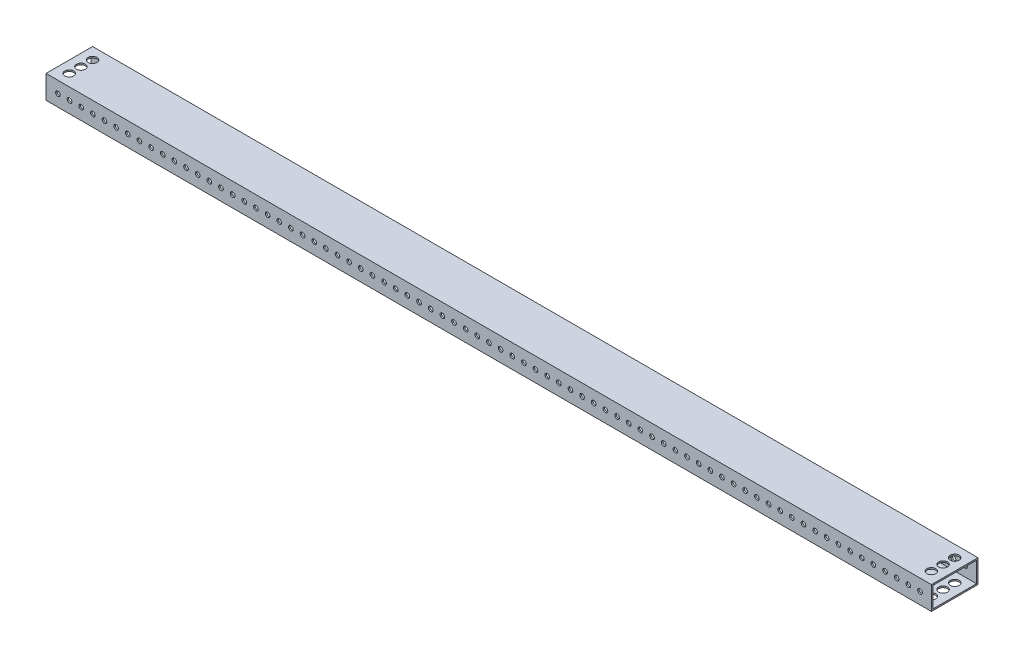
from build123d import *

# Parameters (mm, degrees)
SKETCH1_W           = 965.2
SKETCH1_H           = 50.8
BOSS_EXTRUDE1_DEPTH = 25.4
SKETCH2_W           = 47.577219443
SKETCH2_H           = 22.157059011
CUT_EXTRUDE1_DEPTH  = 966.868189765
SKETCH3_R           = 2.54
CUT_EXTRUDE2_DEPTH  = 486.930612331
SKETCH4_R           = 4.826
CUT_EXTRUDE3_DEPTH  = 484.934995635


with BuildPart() as part:
    # Sketch1 → Boss-Extrude1 (new body)
    with BuildSketch(Plane(origin=(0, 0, 0), x_dir=(1, 0, 0), z_dir=(0, 1, 0))):
        Rectangle(SKETCH1_W, SKETCH1_H)
    extrude(amount=BOSS_EXTRUDE1_DEPTH)

    # Sketch2 → Cut-Extrude1 (cut, through all)
    with BuildSketch(Plane.ZY.offset(482.6)):
        with Locations((0.005055824, 12.705024393)):
            Rectangle(SKETCH2_W, SKETCH2_H)
    extrude(amount=-CUT_EXTRUDE1_DEPTH, mode=Mode.SUBTRACT)

    # Sketch3 → Cut-Extrude2 (cut, through all)
    with BuildSketch(Plane.XY.offset(25.4)):
        with Locations((-469.646, 12.7)):
            Circle(SKETCH3_R)
        with Locations((-456.946, 12.7)):
            Circle(SKETCH3_R)
        with Locations((-444.246, 12.7)):
            Circle(SKETCH3_R)
        with Locations((-431.546, 12.7)):
            Circle(SKETCH3_R)
        with Locations((-418.846, 12.7)):
            Circle(SKETCH3_R)
        with Locations((-406.146, 12.7)):
            Circle(SKETCH3_R)
        with Locations((-393.446, 12.7)):
            Circle(SKETCH3_R)
        with Locations((-380.746, 12.7)):
            Circle(SKETCH3_R)
        with Locations((-368.046, 12.7)):
            Circle(SKETCH3_R)
        with Locations((-355.346, 12.7)):
            Circle(SKETCH3_R)
        with Locations((-342.646, 12.7)):
            Circle(SKETCH3_R)
        with Locations((-329.946, 12.7)):
            Circle(SKETCH3_R)
        with Locations((-317.246, 12.7)):
            Circle(SKETCH3_R)
        with Locations((-304.546, 12.7)):
            Circle(SKETCH3_R)
        with Locations((-291.846, 12.7)):
            Circle(SKETCH3_R)
        with Locations((-279.146, 12.7)):
            Circle(SKETCH3_R)
        with Locations((-266.446, 12.7)):
            Circle(SKETCH3_R)
        with Locations((-253.746, 12.7)):
            Circle(SKETCH3_R)
        with Locations((-241.046, 12.7)):
            Circle(SKETCH3_R)
        with Locations((-228.346, 12.7)):
            Circle(SKETCH3_R)
        with Locations((-215.646, 12.7)):
            Circle(SKETCH3_R)
        with Locations((-202.946, 12.7)):
            Circle(SKETCH3_R)
        with Locations((-190.246, 12.7)):
            Circle(SKETCH3_R)
        with Locations((-177.546, 12.7)):
            Circle(SKETCH3_R)
        with Locations((-164.846, 12.7)):
            Circle(SKETCH3_R)
        with Locations((-152.146, 12.7)):
            Circle(SKETCH3_R)
        with Locations((-139.446, 12.7)):
            Circle(SKETCH3_R)
        with Locations((-126.746, 12.7)):
            Circle(SKETCH3_R)
        with Locations((-114.046, 12.7)):
            Circle(SKETCH3_R)
        with Locations((-101.346, 12.7)):
            Circle(SKETCH3_R)
        with Locations((-88.646, 12.7)):
            Circle(SKETCH3_R)
        with Locations((-75.946, 12.7)):
            Circle(SKETCH3_R)
        with Locations((-63.246, 12.7)):
            Circle(SKETCH3_R)
        with Locations((-50.546, 12.7)):
            Circle(SKETCH3_R)
        with Locations((-37.846, 12.7)):
            Circle(SKETCH3_R)
        with Locations((-25.146, 12.7)):
            Circle(SKETCH3_R)
        with Locations((-12.446, 12.7)):
            Circle(SKETCH3_R)
        with Locations((0.254, 12.7)):
            Circle(SKETCH3_R)
        with Locations((12.954, 12.7)):
            Circle(SKETCH3_R)
        with Locations((25.654, 12.7)):
            Circle(SKETCH3_R)
        with Locations((38.354, 12.7)):
            Circle(SKETCH3_R)
        with Locations((51.054, 12.7)):
            Circle(SKETCH3_R)
        with Locations((63.754, 12.7)):
            Circle(SKETCH3_R)
        with Locations((76.454, 12.7)):
            Circle(SKETCH3_R)
        with Locations((89.154, 12.7)):
            Circle(SKETCH3_R)
        with Locations((101.854, 12.7)):
            Circle(SKETCH3_R)
        with Locations((114.554, 12.7)):
            Circle(SKETCH3_R)
        with Locations((127.254, 12.7)):
            Circle(SKETCH3_R)
        with Locations((139.954, 12.7)):
            Circle(SKETCH3_R)
        with Locations((152.654, 12.7)):
            Circle(SKETCH3_R)
        with Locations((165.354, 12.7)):
            Circle(SKETCH3_R)
        with Locations((178.054, 12.7)):
            Circle(SKETCH3_R)
        with Locations((190.754, 12.7)):
            Circle(SKETCH3_R)
        with Locations((203.454, 12.7)):
            Circle(SKETCH3_R)
        with Locations((216.154, 12.7)):
            Circle(SKETCH3_R)
        with Locations((228.854, 12.7)):
            Circle(SKETCH3_R)
        with Locations((241.554, 12.7)):
            Circle(SKETCH3_R)
        with Locations((254.254, 12.7)):
            Circle(SKETCH3_R)
        with Locations((266.954, 12.7)):
            Circle(SKETCH3_R)
        with Locations((279.654, 12.7)):
            Circle(SKETCH3_R)
        with Locations((292.354, 12.7)):
            Circle(SKETCH3_R)
        with Locations((305.054, 12.7)):
            Circle(SKETCH3_R)
        with Locations((317.754, 12.7)):
            Circle(SKETCH3_R)
        with Locations((330.454, 12.7)):
            Circle(SKETCH3_R)
        with Locations((343.154, 12.7)):
            Circle(SKETCH3_R)
        with Locations((355.854, 12.7)):
            Circle(SKETCH3_R)
        with Locations((368.554, 12.7)):
            Circle(SKETCH3_R)
        with Locations((381.254, 12.7)):
            Circle(SKETCH3_R)
        with Locations((393.954, 12.7)):
            Circle(SKETCH3_R)
        with Locations((406.654, 12.7)):
            Circle(SKETCH3_R)
        with Locations((419.354, 12.7)):
            Circle(SKETCH3_R)
        with Locations((432.054, 12.7)):
            Circle(SKETCH3_R)
        with Locations((444.754, 12.7)):
            Circle(SKETCH3_R)
        with Locations((457.454, 12.7)):
            Circle(SKETCH3_R)
        with Locations((470.154, 12.7)):
            Circle(SKETCH3_R)
    extrude(amount=-CUT_EXTRUDE2_DEPTH, mode=Mode.SUBTRACT)

    # Sketch4 → Cut-Extrude3 (cut, through all)
    with BuildSketch(Plane(origin=(0, 25.4, 0), x_dir=(1, 0, 0), z_dir=(0, 1, 0))):
        with Locations(Location((-469.9, 12.7, 0), (0, 0, 270))):
            Circle(SKETCH4_R)
        with Locations(Location((-469.9, -12.7, 0), (0, 0, 270))):
            Circle(SKETCH4_R)
        with Locations(Location((-469.9, 0, 0), (0, 0, 270))):
            Circle(SKETCH4_R)
        with Locations(Location((469.9, 12.7, 0), (0, 0, 270))):
            Circle(SKETCH4_R)
        with Locations(Location((469.9, 0, 0), (0, 0, 270))):
            Circle(SKETCH4_R)
        with Locations(Location((469.9, -12.7, 0), (0, 0, 270))):
            Circle(SKETCH4_R)
    extrude(amount=-CUT_EXTRUDE3_DEPTH, mode=Mode.SUBTRACT)


solid = part.part
